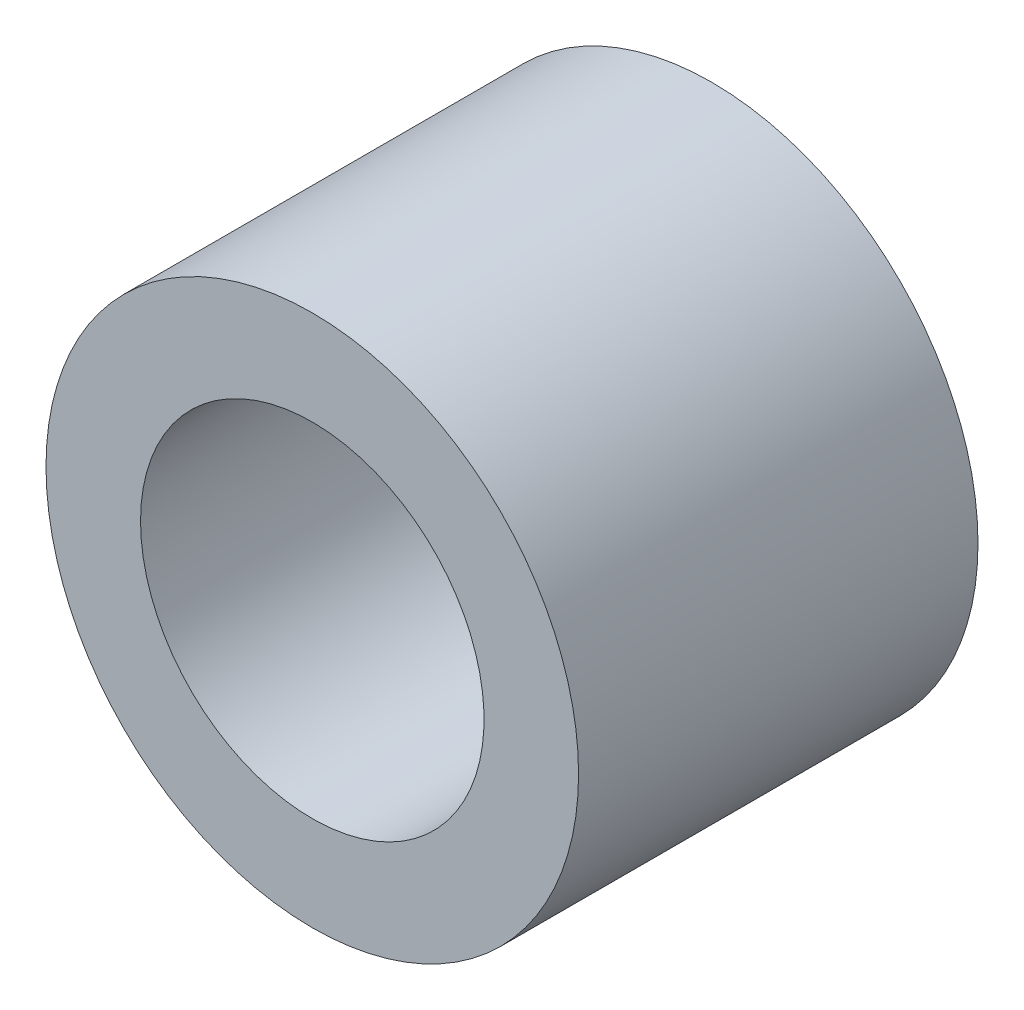
from build123d import *

# Parameters (mm, degrees)
SKETCH1_R      = 2.54
SKETCH1_R_2    = 1.6383
EXTRUDE1_DEPTH = 3.81


with BuildPart() as part:
    # Sketch1 → Extrude1 (new body)
    with BuildSketch(Plane.XY):
        with Locations(Location((0, 0, 0), (0, 0, 180))):
            Circle(SKETCH1_R)
        with Locations(Location((0, 0, 0), (0, 0, 180))):
            Circle(SKETCH1_R_2, mode=Mode.SUBTRACT)
    extrude(amount=EXTRUDE1_DEPTH)


solid = part.part
